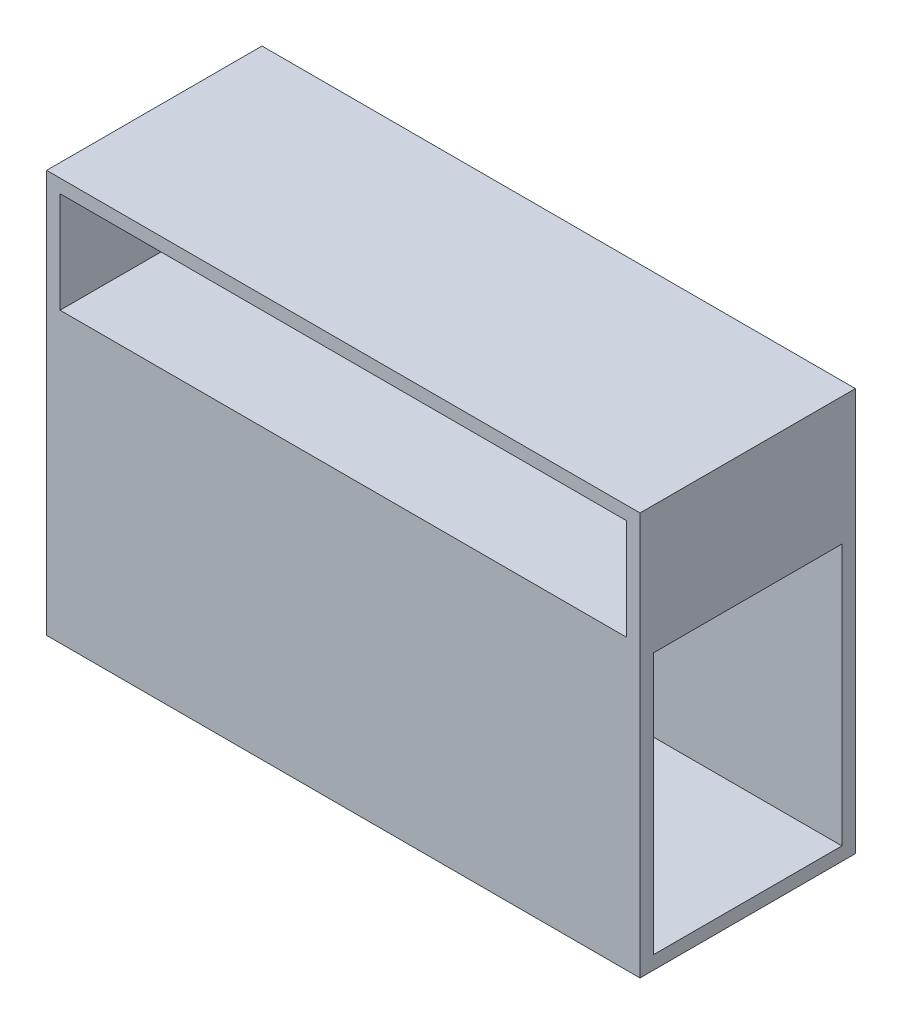
from build123d import *

# Parameters (mm, degrees)
SKETCH1_W           = 88.168408076
SKETCH1_H           = 59.84281091
BOSS_EXTRUDE4_DEPTH = 2
SKETCH2_W           = 2
SKETCH2_H           = 59.84281091
BOSS_EXTRUDE5_DEPTH = 30
SKETCH3_W           = 84.168408076
SKETCH3_H           = 2
BOSS_EXTRUDE6_DEPTH = 30
SKETCH4_W           = 30
SKETCH4_H           = 38.84281091
CUT_EXTRUDE1_DEPTH  = 30
SKETCH5_W           = 2
SKETCH5_H           = 38.84281091
BOSS_EXTRUDE7_DEPTH = 86.168408075
SKETCH6_W           = 28
SKETCH6_H           = 38.84281091
CUT_EXTRUDE2_DEPTH  = 97.665842233


with BuildPart() as part:
    # Sketch1 → Boss-Extrude4 (new body)
    with BuildSketch(Plane.XY):
        Rectangle(SKETCH1_W, SKETCH1_H)
    extrude(amount=BOSS_EXTRUDE4_DEPTH)

    # Sketch2 → Boss-Extrude5 (add)
    with BuildSketch(Plane.XY.offset(2)):
        with Locations((-43.084204038, 0)):
            Rectangle(SKETCH2_W, SKETCH2_H)
        with Locations((43.084204038, 0)):
            Rectangle(SKETCH2_W, SKETCH2_H)
    extrude(amount=BOSS_EXTRUDE5_DEPTH)

    # Sketch3 → Boss-Extrude6 (add)
    with BuildSketch(Plane.XY.offset(2)):
        with Locations((0, 28.921405455)):
            Rectangle(SKETCH3_W, SKETCH3_H)
        with Locations((0, -28.921405455)):
            Rectangle(SKETCH3_W, SKETCH3_H)
        with Locations((0, 11.921405455)):
            Rectangle(SKETCH3_W, SKETCH3_H)
    extrude(amount=BOSS_EXTRUDE6_DEPTH)

    # Sketch4 → Cut-Extrude1 (cut)
    with BuildSketch(Plane(origin=(-42.084204038, 0, 0), x_dir=(0, 0, -1), z_dir=(1, 0, 0))):
        with Locations((-17, -8.5)):
            Rectangle(SKETCH4_W, SKETCH4_H)
    extrude(amount=-CUT_EXTRUDE1_DEPTH, mode=Mode.SUBTRACT)

    # Sketch5 → Boss-Extrude7 (add)
    with BuildSketch(Plane.ZY.offset(-42.084204038)):
        with Locations((31, -8.5)):
            Rectangle(SKETCH5_W, SKETCH5_H)
    extrude(amount=BOSS_EXTRUDE7_DEPTH)

    # Sketch6 → Cut-Extrude2 (cut, through all)
    with BuildSketch(Plane.ZY.offset(-42.084204038)):
        with Locations((16, -8.5)):
            Rectangle(SKETCH6_W, SKETCH6_H)
    extrude(amount=-CUT_EXTRUDE2_DEPTH, mode=Mode.SUBTRACT)


solid = part.part
